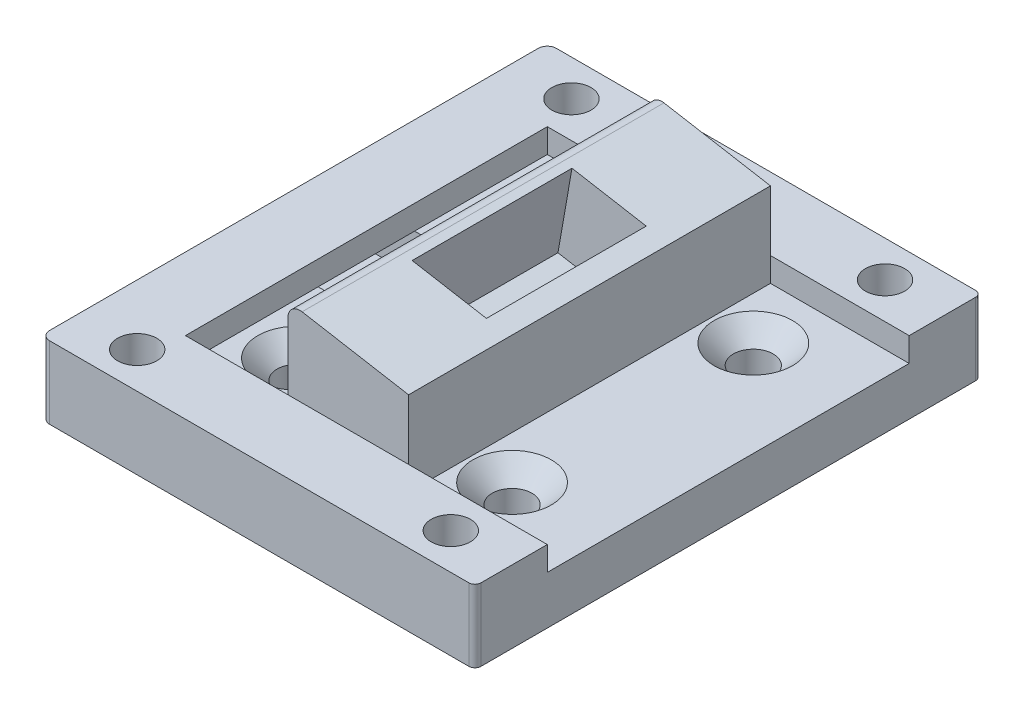
from build123d import *

# Parameters (mm, degrees)
SKETCH1_W                = 30
SKETCH1_H                = 30
BASE_PLATE_DEPTH         = 1.5
SIDE_WALLS_DEPTH         = 6
SKETCH3_W                = 10
SKETCH3_H                = 30
SWITCH_BLOCK_DEPTH       = 9.5
SKETCH11_W               = 8.5
SKETCH11_H               = 30
SKETCH11_W_2             = 11.5
THICKER_BODY_DEPTH       = 2.5
SWITCH_BLOCK_ANGLE_DEPTH = 30
SKETCH6_W                = 6.25
SKETCH6_H                = 13.25
SWITCH_POCKET_DEPTH      = 6.75
WIRE_CHANNEL_1_REACH     = 33.348
SKETCH7_W                = 2.75
SKETCH7_H                = 13.25
SKETCH19_W               = 2.79179182
SKETCH19_H               = 13.25
SWITCH_REMOVER_DEPTH     = 10
SKETCH4_R                = 1.625
M2_SCREWS_DEPTH          = 6
M2_NUTS_DEPTH            = 2
SKETCH17_R               = 1.65
M3_MOUNTING_SCREWS_DEPTH = 31.960660523
WIRE_CHANNEL_REACH       = 32.267
SKETCH8_W                = 8
SKETCH8_H                = 3.25
FILLET1_R                = 1
FILLET2_R                = 0.5
FILLET3_R                = 0.5
FILLET4_R                = 0.75
FILLET5_R                = 0.75


with BuildPart() as part:
    # Sketch1 → Base Plate (new body)
    with BuildSketch(Plane(origin=(0, 0, 0), x_dir=(1, 0, 0), z_dir=(0, 1, 0))):
        Rectangle(SKETCH1_W, SKETCH1_H)
    extrude(amount=BASE_PLATE_DEPTH)

    # Sketch2 → Side Walls (add)
    with BuildSketch(Plane.XZ):
        Polygon((15, 15), (-15, 15), (-15, -15), (15, -15), (15, -21), (-21, -21), (-21, 21), (15, 21), align=None)
    extrude(amount=-SIDE_WALLS_DEPTH)

    # Sketch3 → Switch Block (add)
    with BuildSketch(Plane(origin=(0, 1.5, 0), x_dir=(1, 0, 0), z_dir=(0, 1, 0))):
        with Locations((-1.5, 0)):
            Rectangle(SKETCH3_W, SKETCH3_H)
    extrude(amount=SWITCH_BLOCK_DEPTH)

    # Sketch11 → Thicker Body (add)
    with BuildSketch(Plane(origin=(0, 1.5, 0), x_dir=(1, 0, 0), z_dir=(0, 1, 0))):
        with Locations((-10.75, 0)):
            Rectangle(SKETCH11_W, SKETCH11_H)
        with Locations((9.25, 0)):
            Rectangle(SKETCH11_W_2, SKETCH11_H)
    extrude(amount=THICKER_BODY_DEPTH)

    # Sketch5 → Switch Block Angle (add)
    with BuildSketch(Plane(origin=(0, 0, -15), x_dir=(-1, 0, 0), z_dir=(0, 0, -1))):
        Polygon((6.5, 11), (6.5, 12.75), (-3.5, 11), align=None)
    extrude(amount=-SWITCH_BLOCK_ANGLE_DEPTH)

    # Sketch6 → Switch Pocket (cut)
    with BuildSketch(Plane(origin=(1.971801092, 11.267434809, 0), x_dir=(0.9850304671557043, -0.17238033175224804, 0), z_dir=(0.17238033175224804, 0.9850304671557043, 0))):
        with Locations((-3.52456214, 0)):
            Rectangle(SKETCH6_W, SKETCH6_H)
    extrude(amount=-SWITCH_POCKET_DEPTH, mode=Mode.SUBTRACT)

    # Wire Channel 1: up to this plane
    wire_channel_1_end = Plane(origin=(0, 1, 0), z_dir=(0, 1, 0))
    # Sketch7 → Wire Channel 1 (cut, up to the surface)
    with BuildSketch(Plane(origin=(0.808233852, 4.618479156, 0), x_dir=(0.9850304671557043, -0.17238033175224815, 0), z_dir=(0.17238033175224815, 0.9850304671557043, 0)), mode=Mode.PRIVATE) as wire_channel_1_sk1:
        with Locations((-3.52456214, 0)):
            Rectangle(SKETCH7_W, SKETCH7_H)
    wire_channel_1_tool1 = split(extrude(wire_channel_1_sk1.sketch, amount=-WIRE_CHANNEL_1_REACH, mode=Mode.PRIVATE), bisect_by=wire_channel_1_end, keep=Keep.BOTH, mode=Mode.PRIVATE)
    add(wire_channel_1_tool1.solids().sort_by_distance((-2.663567, 5.226044, 0))[0], mode=Mode.SUBTRACT)

    # Sketch19 → Switch Remover (cut)
    with BuildSketch(Plane(origin=(0, 1, 0), x_dir=(1, 0, 0), z_dir=(0, 1, 0))):
        with Locations((-3.403125, 0)):
            Rectangle(SKETCH19_W, SKETCH19_H)
    extrude(amount=-SWITCH_REMOVER_DEPTH, mode=Mode.SUBTRACT)

    # Sketch4 → M2 Screws (cut)
    with BuildSketch(Plane(origin=(0, 6, 0), x_dir=(1, 0, 0), z_dir=(0, 1, 0))):
        with Locations(Location((-16, -18, 0), (0, 0, 270))):
            Circle(SKETCH4_R)
        with Locations(Location((10, -18, 0), (0, 0, 270))):
            Circle(SKETCH4_R)
        with Locations(Location((10, 18, 0), (0, 0, 270))):
            Circle(SKETCH4_R)
        with Locations(Location((-16, 18, 0), (0, 0, 270))):
            Circle(SKETCH4_R)
    extrude(amount=-M2_SCREWS_DEPTH, mode=Mode.SUBTRACT)

    # Sketch16 → M2 Nuts (cut)
    with BuildSketch(Plane.XZ):
        Polygon((-14.773130678, 15.875), (-13.546261356, 18), (-14.773130678, 20.125), (-17.226869322, 20.125), (-18.453738644, 18), (-17.226869322, 15.875), align=None)
        Polygon((-17.226869322, -15.875), (-14.773130678, -15.875), (-13.546261356, -18), (-14.773130678, -20.125), (-17.226869322, -20.125), (-18.453738644, -18), align=None)
        Polygon((11.226869322, 15.875), (12.453738644, 18), (11.226869322, 20.125), (8.773130678, 20.125), (7.546261356, 18), (8.773130678, 15.875), align=None)
        Polygon((8.773130678, -15.875), (11.226869322, -15.875), (12.453738644, -18), (11.226869322, -20.125), (8.773130678, -20.125), (7.546261356, -18), align=None)
    extrude(amount=-M2_NUTS_DEPTH, mode=Mode.SUBTRACT)

    # Sketch17 → M3 Mounting Screws (cut, through all)
    with BuildSketch(Plane(origin=(0, 4, 0), x_dir=(1, 0, 0), z_dir=(0, 1, 0))):
        with Locations(Location((7.078853568, 10, 0), (0, 0, 270))):
            Circle(SKETCH17_R)
        with Locations(Location((7.078853568, -10, 0), (0, 0, 270))):
            Circle(SKETCH17_R)
        with Locations(Location((-10.75, -10, 0), (0, 0, 270))):
            Circle(SKETCH17_R)
        with Locations(Location((-10.75, 10, 0), (0, 0, 270))):
            Circle(SKETCH17_R)
    extrude(amount=-M3_MOUNTING_SCREWS_DEPTH, mode=Mode.SUBTRACT)

    # M3 Heads cone 1 section (through the dimple's axis) → M3 Heads (revolve, cut)
    with BuildSketch(Plane(origin=(7.078853568, 4, -10), x_dir=(0, 0, 1), z_dir=(1, 0, 0))):
        Polygon((0, 0), (3.25, 0), (0, 3.25), align=None)
    revolve(axis=Axis((7.078853568, 4, -10), (0, -1, 0)), mode=Mode.SUBTRACT)

    # M3 Heads cone 2 section (through the dimple's axis) → M3 Heads cone 2 (revolve, cut)
    with BuildSketch(Plane(origin=(7.078853568, 4, 10), x_dir=(0, 0, 1), z_dir=(1, 0, 0))):
        Polygon((0, 0), (3.25, 0), (0, 3.25), align=None)
    revolve(axis=Axis((7.078853568, 4, 10), (0, -1, 0)), mode=Mode.SUBTRACT)

    # M3 Heads cone 3 section (through the dimple's axis) → M3 Heads cone 3 (revolve, cut)
    with BuildSketch(Plane(origin=(-10.75, 4, 10), x_dir=(0, 0, 1), z_dir=(1, 0, 0))):
        Polygon((0, 0), (3.25, 0), (0, 3.25), align=None)
    revolve(axis=Axis((-10.75, 4, 10), (0, -1, 0)), mode=Mode.SUBTRACT)

    # M3 Heads cone 4 section (through the dimple's axis) → M3 Heads cone 4 (revolve, cut)
    with BuildSketch(Plane(origin=(-10.75, 4, -10), x_dir=(0, 0, 1), z_dir=(1, 0, 0))):
        Polygon((0, 0), (3.25, 0), (0, 3.25), align=None)
    revolve(axis=Axis((-10.75, 4, -10), (0, -1, 0)), mode=Mode.SUBTRACT)

    # Wire Channel: up to this face of the body (flat: up to its plane)
    wire_channel_end = Plane(part.part.faces().sort_by_distance((-21, 3, 0))[0])
    # Sketch8 → Wire Channel (cut, up to the picked face)
    with BuildSketch(Plane(origin=(-4.017984132, 2.099725317, 0), x_dir=(0, 0, 1), z_dir=(-1, 0, 0)), mode=Mode.PRIVATE) as wire_channel_sk1:
        with Locations((0, 0.275274683)):
            Rectangle(SKETCH8_W, SKETCH8_H)
    wire_channel_tool1 = split(extrude(wire_channel_sk1.sketch, amount=WIRE_CHANNEL_REACH, mode=Mode.PRIVATE), bisect_by=wire_channel_end, keep=Keep.BOTH, mode=Mode.PRIVATE)
    add(wire_channel_tool1.solids().sort_by(Axis((-4.017984, 2.375, 0), (-1, 0, 0)))[0], mode=Mode.SUBTRACT)

    # Fillet1
    fillet1_edges = [part.edges().sort_by_distance(p)[0] for p in [
        (-6.5, 12.75, 0),
    ]]
    fillet(fillet1_edges, radius=FILLET1_R)

    # Fillet2
    fillet2_edges = [part.edges().sort_by_distance(p)[0] for p in [
        (15, 3, 21),
    ]]
    fillet(fillet2_edges, radius=FILLET2_R)

    # Fillet3
    fillet3_edges = [part.edges().sort_by_distance(p)[0] for p in [
        (15, 3, -21),
    ]]
    fillet(fillet3_edges, radius=FILLET3_R)

    # Fillet4
    fillet4_edges = [part.edges().sort_by_distance(p)[0] for p in [
        (-21, 3, -21),
    ]]
    fillet(fillet4_edges, radius=FILLET4_R)

    # Fillet5
    fillet5_edges = [part.edges().sort_by_distance(p)[0] for p in [
        (-21, 3, 21),
    ]]
    fillet(fillet5_edges, radius=FILLET5_R)


solid = part.part
